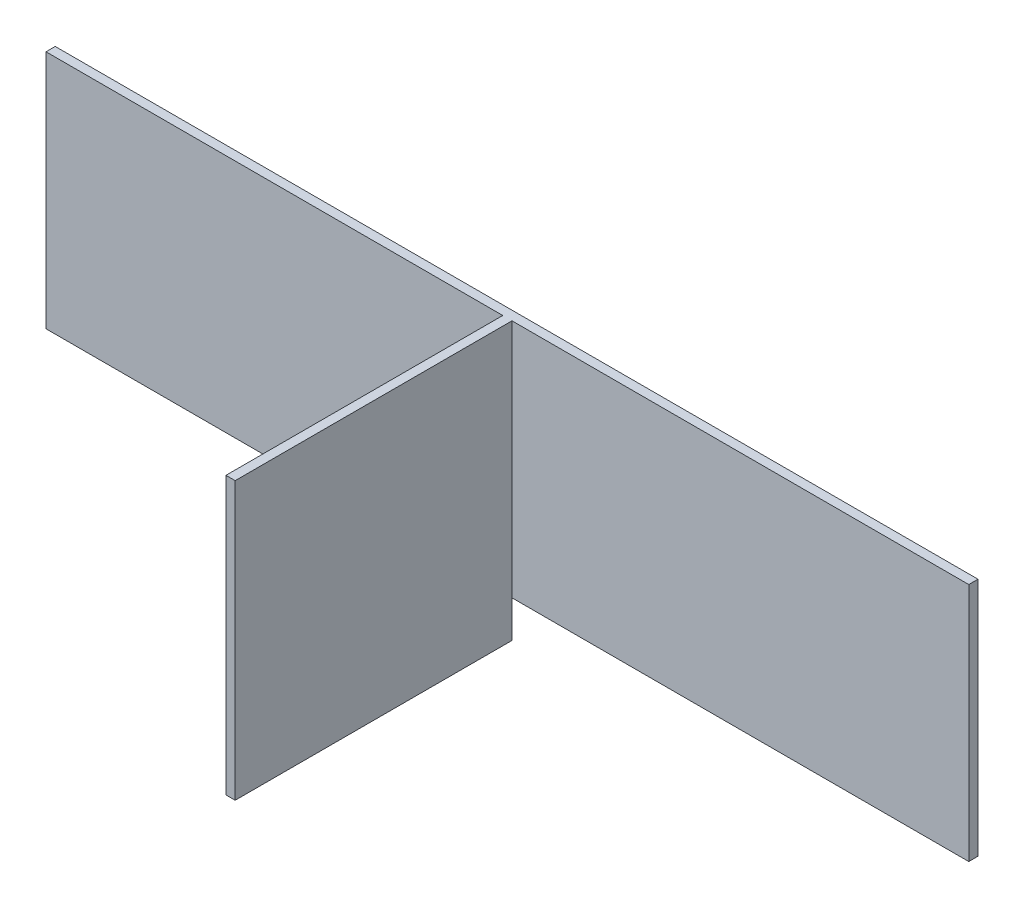
from build123d import *

# Parameters (mm, degrees)
SKETCH1_W           = 500
SKETCH1_H           = 130
BOSS_EXTRUDE1_DEPTH = 5
SKETCH2_W           = 5
SKETCH2_H           = 130
BOSS_EXTRUDE2_DEPTH = 150
SKETCH3_W           = 5
SKETCH3_H           = 150
BOSS_EXTRUDE3_DEPTH = 20


with BuildPart() as part:
    # Sketch1 → Boss-Extrude1 (new body)
    with BuildSketch(Plane.XY):
        Rectangle(SKETCH1_W, SKETCH1_H)
    extrude(amount=BOSS_EXTRUDE1_DEPTH)

    # Sketch2 → Boss-Extrude2 (add)
    with BuildSketch(Plane.XY.offset(5)):
        Rectangle(SKETCH2_W, SKETCH2_H)
    extrude(amount=BOSS_EXTRUDE2_DEPTH)

    # Sketch3 → Boss-Extrude3 (add)
    with BuildSketch(Plane(origin=(0, -65, 0), x_dir=(-1, 0, 0), z_dir=(0, -1, 0))):
        with Locations((0, -80)):
            Rectangle(SKETCH3_W, SKETCH3_H)
    extrude(amount=BOSS_EXTRUDE3_DEPTH)


solid = part.part
